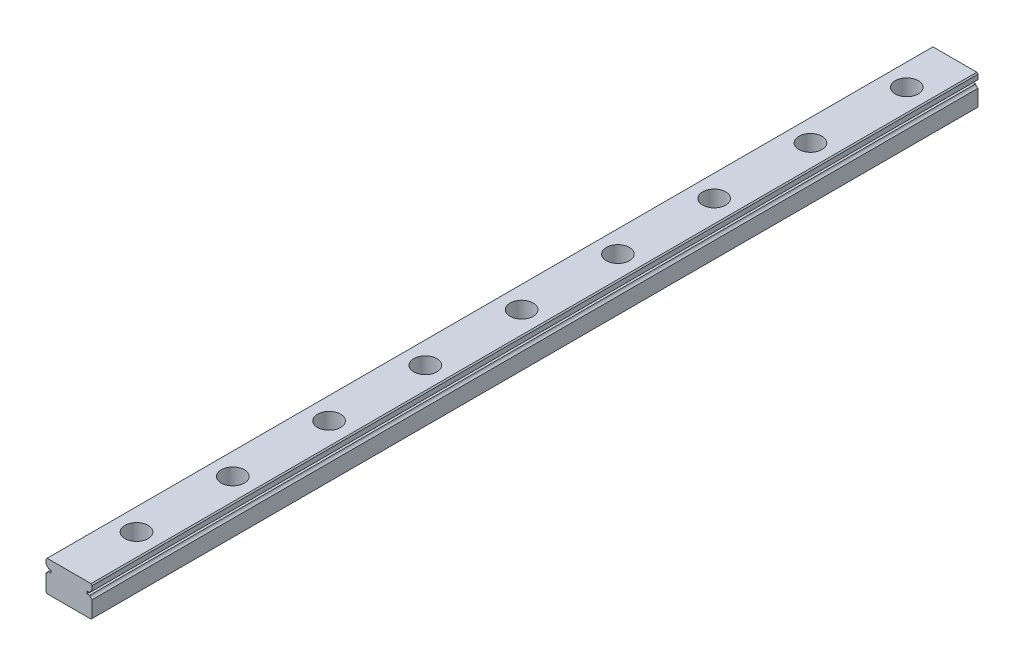
from build123d import *

# Parameters (mm, degrees)
EXTRUDE_1_DEPTH        = 230
SKETCH_2_R             = 3
SKETCH_2_R_2           = 1.75
CUT_EXTRUDE_1_DEPTH    = 4.5
SKETCH_2_2_R           = 1.75
CUT_EXTRUDE_2_DEPTH    = 231.217288664
PATTERN_LINEAR_1_COUNT = 10
PATTERN_LINEAR_1_PITCH = 25


with BuildPart() as part:
    # Эскиз1 → Бобышка-Вытянуть1 (new body)
    with BuildSketch(Plane.XY):
        with BuildLine():
            Line((-6, 3.7), (-5.7, 4))
            Line((-5.7, 4), (5.7, 4))
            Line((5.7, 4), (6, 3.7))
            Line((6, 3.7), (6, 2.451013544))
            ThreePointArc((6, 2.451013544), (5.597935912, 2.202976267), (5.354599002, 1.798050138))
            Line((5.354599002, 1.798050138), (4.643514056, 1.798050138))
            Line((4.643514056, 1.798050138), (4.643514056, 1.201949862))
            Line((4.643514056, 1.201949862), (5.354599002, 1.201949862))
            ThreePointArc((5.354599002, 1.201949862), (5.597935912, 0.797023733), (6, 0.548986456))
            Line((6, 0.548986456), (6, -3.7))
            Line((6, -3.7), (5.7, -4))
            Line((5.7, -4), (-5.7, -4))
            Line((-5.7, -4), (-6, -3.7))
            Line((-6, -3.7), (-6, 0.548986456))
            ThreePointArc((-6, 0.548986456), (-5.597935912, 0.797023733), (-5.354599002, 1.201949862))
            Line((-5.354599002, 1.201949862), (-4.643514056, 1.201949862))
            Line((-4.643514056, 1.201949862), (-4.643514056, 1.798050138))
            Line((-4.643514056, 1.798050138), (-5.354599002, 1.798050138))
            ThreePointArc((-5.354599002, 1.798050138), (-5.597935912, 2.202976267), (-6, 2.451013544))
            Line((-6, 2.451013544), (-6, 3.7))
        make_face()
    extrude(amount=EXTRUDE_1_DEPTH)

    # Эскиз2 → Вырез-Вытянуть1 (cut)
    with BuildSketch(Plane(origin=(0, 4, 0), x_dir=(1, 0, 0), z_dir=(0, 1, 0))):
        with Locations((0, -12.5)):
            Circle(SKETCH_2_R)
        with Locations((0, -12.5)):
            Circle(SKETCH_2_R_2, mode=Mode.SUBTRACT)
    cut_extrude_1 = extrude(amount=-CUT_EXTRUDE_1_DEPTH, mode=Mode.SUBTRACT)

    # Эскиз2<2> → Вырез-Вытянуть2 (cut, through all)
    with BuildSketch(Plane(origin=(0, 4, 0), x_dir=(1, 0, 0), z_dir=(0, 1, 0))):
        with Locations((0, -12.5)):
            Circle(SKETCH_2_2_R)
    cut_extrude_2 = extrude(amount=-CUT_EXTRUDE_2_DEPTH, mode=Mode.SUBTRACT)

    # Линейный массив1: Вырез-Вытянуть1, Вырез-Вытянуть2 ×10
    with Locations(*[(0, 0, i * PATTERN_LINEAR_1_PITCH) for i in range(1, PATTERN_LINEAR_1_COUNT)]):
        add(cut_extrude_1, mode=Mode.SUBTRACT)
        add(cut_extrude_2, mode=Mode.SUBTRACT)


solid = part.part
